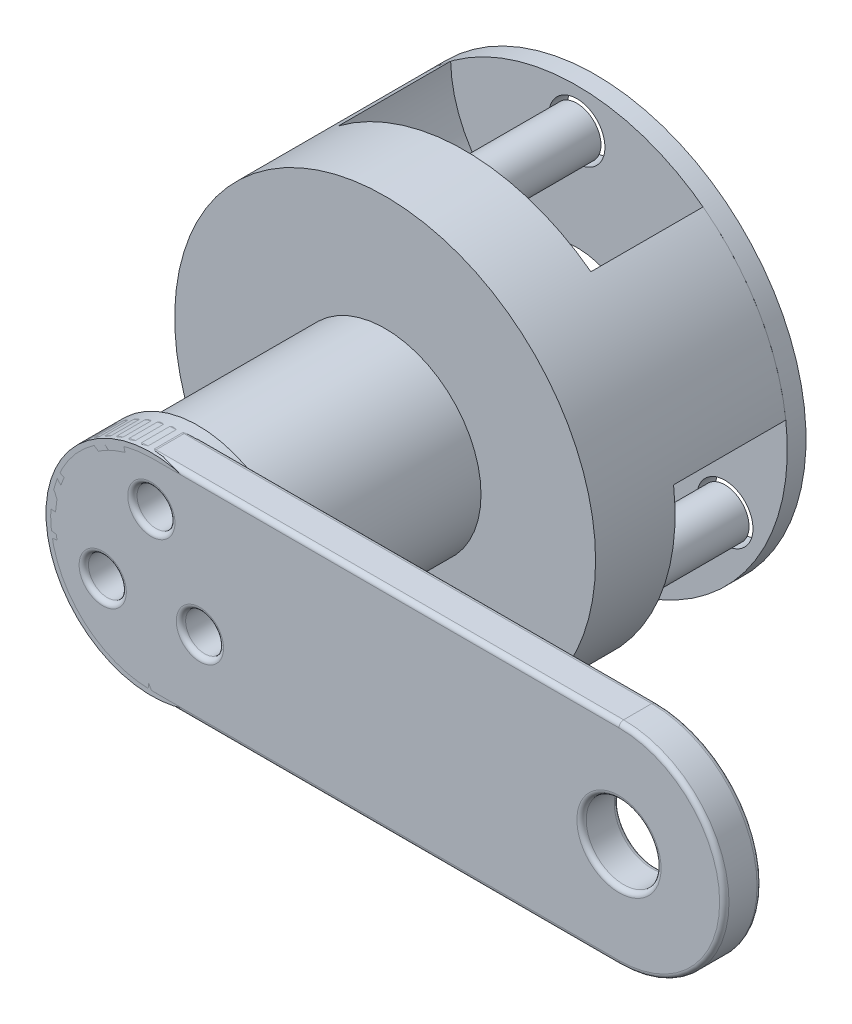
from build123d import *

# Parameters (mm, degrees)
BOSS_EXTRUDE1_DEPTH           = 2
BOSS_EXTRUDE1_DEPTH_BACK      = 17
SKETCH2_R                     = 22.5
CUT_EXTRUDE1_DEPTH            = 12
BOSS_EXTRUDE2_START           = -1.5
SKETCH4_R                     = 2.575
BOSS_EXTRUDE2_DEPTH           = 13.5
CIRPATTERN1_COUNT             = 3
SKETCH5_R                     = 11.15
BEARINGHOLE_DEPTH             = 7
BEARINGHOLE_DIRECTION_2_REACH = 36.007
SKETCH8_R                     = 22.5
BOSS_EXTRUDE4_DEPTH           = 1.5
SKETCH6_R                     = 10.25
BOSS_EXTRUDE3_DEPTH           = 20
FILLET1_R                     = 0.5
CIRPATTERN2_COUNT             = 3
SKETCH9_R                     = 22.5
SKETCH9_R_2                   = 7.5
SKETCH9_R_3                   = 3
SKETCH9_R_4                   = 2.25
BOSS_EXTRUDE5_DEPTH           = 2
SKETCH13_R                    = 11.265
SKETCH13_R_2                  = 10.265
BOSS_EXTRUDE6_DEPTH           = 5
SKETCH14_R                    = 2.025
SKETCH14_R_2                  = 4
BOSS_EXTRUDE7_DEPTH           = 4
FILLET2_R                     = 0.5


with BuildPart() as part:
    # Sketch2 → Boss-Extrude1 (new, two sides: drawn at the far end of the back side and taken through both)
    with BuildSketch(Plane.XY.offset(-BOSS_EXTRUDE1_DEPTH_BACK)):
        Circle(SKETCH2_R)
    extrude(amount=BOSS_EXTRUDE1_DEPTH + BOSS_EXTRUDE1_DEPTH_BACK)

    # Sketch3 → Cut-Extrude1 (cut)
    with BuildSketch(Plane(origin=(0, 0, -17), x_dir=(-1, 0, 0), z_dir=(0, 0, -1))):
        with BuildLine():
            ThreePointArc((5.14266063, 5.797891138), (0, 31.78), (-5.14266063, 5.797891138))
            ThreePointArc((-5.14266063, 5.797891138), (-6.711696879, 3.875), (-7.592451329, 1.55472918))
            ThreePointArc((-7.592451329, 1.55472918), (-27.522287332, -15.89), (-2.449790699, -7.352620317))
            ThreePointArc((-2.449790699, -7.352620317), (0, -7.75), (2.449790699, -7.352620317))
            ThreePointArc((2.449790699, -7.352620317), (27.522287332, -15.89), (7.592451329, 1.55472918))
            ThreePointArc((7.592451329, 1.55472918), (6.711696879, 3.875), (5.14266063, 5.797891138))
        make_face()
    extrude(amount=-CUT_EXTRUDE1_DEPTH, mode=Mode.SUBTRACT)

    # Sketch4 → Boss-Extrude2 (add)
    with BuildSketch(Plane(origin=(0, 0, -5), x_dir=(-1, 0, 0), z_dir=(0, 0, -1)).offset(BOSS_EXTRUDE2_START)):
        with Locations((0, 18.28)):
            Circle(SKETCH4_R)
    boss_extrude2 = extrude(amount=BOSS_EXTRUDE2_DEPTH)

    # CirPattern1: Boss-Extrude2 ×3 about axis
    cirpattern1_axis = Axis((0, 0, 0), (0, 0, 1))
    for i in range(1, CIRPATTERN1_COUNT):
        add(boss_extrude2.rotate(cirpattern1_axis, i * 360 / CIRPATTERN1_COUNT))

    # Sketch5 → bearingHole (cut)
    with BuildSketch(Plane(origin=(0, 0, -5), x_dir=(-1, 0, 0), z_dir=(0, 0, -1))):
        with Locations(Location((0, 0, 0), (0, 0, 162.658546609))):
            Circle(SKETCH5_R)
    extrude(amount=-BEARINGHOLE_DEPTH, mode=Mode.SUBTRACT)

    # bearingHole direction 2: up to this face of the body (flat: up to its plane)
    bearinghole_direction_2_end = Plane(part.part.faces().sort_by_distance((0, -16.708840738, -17))[0])
    # Sketch5 → bearingHole direction 2 (cut, up to the picked face)
    with BuildSketch(Plane(origin=(0, 0, -5), x_dir=(-1, 0, 0), z_dir=(0, 0, -1)), mode=Mode.PRIVATE) as bearinghole_direction_2_sk1:
        with Locations(Location((0, 0, 0), (0, 0, 162.658546609))):
            Circle(SKETCH5_R)
    bearinghole_direction_2_tool1 = split(extrude(bearinghole_direction_2_sk1.sketch, amount=BEARINGHOLE_DIRECTION_2_REACH, mode=Mode.PRIVATE), bisect_by=bearinghole_direction_2_end, keep=Keep.BOTH, mode=Mode.PRIVATE)
    add(bearinghole_direction_2_tool1.solids().sort_by(Axis((0, 0, -5), (0, 0, -1)))[0], mode=Mode.SUBTRACT)

    # Sketch8 → Boss-Extrude4 (add)
    with BuildSketch(Plane.XY.offset(2)):
        with Locations(Location((0, 0, 0), (0, 0, 173.13920452))):
            Circle(SKETCH8_R)
    extrude(amount=BOSS_EXTRUDE4_DEPTH)

    # Sketch6 → Boss-Extrude3 (add)
    with BuildSketch(Plane.XY.offset(3.5)):
        Circle(SKETCH6_R)
    extrude(amount=BOSS_EXTRUDE3_DEPTH)

    # Fillet1
    fillet1_edges = [part.edges().sort_by_distance(p)[0] for p in [
        (-10.643181204, -3.323431037, 2),
    ]]
    fillet(fillet1_edges, radius=FILLET1_R)

    # Sketch11 → Ø4.0mm Dowel Hole1 (revolve, cut)
    with BuildSketch(Plane(origin=(0, 6, 23.5), x_dir=(0, -1, 0), z_dir=(1, 0, 0))):
        Polygon((0, 0), (0, 5), (2, 3.798278762), (2, 0.025), (2.025, 0), align=None)
    f_4_0mm_dowel_hole1 = revolve(axis=Axis((0, 6, 29.85), (0, 0, -1)), mode=Mode.SUBTRACT)

    # CirPattern2: Ø4.0mm Dowel Hole1 ×3 about axis
    cirpattern2_axis = Axis((0, 0, 0), (0, 0, 1))
    for i in range(1, CIRPATTERN2_COUNT):
        add(f_4_0mm_dowel_hole1.rotate(cirpattern2_axis, i * 360 / CIRPATTERN2_COUNT), mode=Mode.SUBTRACT)


with BuildPart() as body_2:
    # Sketch9 → Boss-Extrude5 (new body)
    with BuildSketch(Plane(origin=(0, 0, -17), x_dir=(-1, 0, 0), z_dir=(0, 0, -1))):
        Circle(SKETCH9_R)
        Circle(SKETCH9_R_2, mode=Mode.SUBTRACT)
        with Locations((0, 18.28)):
            Circle(SKETCH9_R_3, mode=Mode.SUBTRACT)
        with Locations((15.830944381, -9.14)):
            Circle(SKETCH9_R_3, mode=Mode.SUBTRACT)
        with Locations((-15.830944381, -9.14)):
            Circle(SKETCH9_R_3, mode=Mode.SUBTRACT)
        with Locations((15.207753976, 8.780200852)):
            Circle(SKETCH9_R_4, mode=Mode.SUBTRACT)
        with Locations((0, -17.560401703)):
            Circle(SKETCH9_R_4, mode=Mode.SUBTRACT)
        with Locations((-15.207753976, 8.780200852)):
            Circle(SKETCH9_R_4, mode=Mode.SUBTRACT)
    extrude(amount=BOSS_EXTRUDE5_DEPTH)


with BuildPart() as body_3:
    # Sketch13 → Boss-Extrude6 (new body)
    with BuildSketch(Plane.XY.offset(23.5)):
        Circle(SKETCH13_R)
        Circle(SKETCH13_R_2, mode=Mode.SUBTRACT)
    extrude(amount=BOSS_EXTRUDE6_DEPTH)


with BuildPart() as body_4:
    # Sketch14 → Boss-Extrude7 (new body)
    with BuildSketch(Plane.XY.offset(28.5)):
        with BuildLine():
            Line((0, 11.265), (50, 11.265))
            ThreePointArc((50, 11.265), (61.265, 0), (50, -11.265))
            Line((50, -11.265), (0, -11.265))
            ThreePointArc((0, -11.265), (-11.265, 0), (0, 11.265))
        make_face()
        with Locations((0, 6)):
            Circle(SKETCH14_R, mode=Mode.SUBTRACT)
        with Locations((5.196152423, -3)):
            Circle(SKETCH14_R, mode=Mode.SUBTRACT)
        with Locations((-5.196152423, -3)):
            Circle(SKETCH14_R, mode=Mode.SUBTRACT)
        with Locations((50, 0)):
            Circle(SKETCH14_R_2, mode=Mode.SUBTRACT)
    extrude(amount=-BOSS_EXTRUDE7_DEPTH)

    # Fillet2
    fillet2_edges = [body_4.edges().sort_by_distance(p)[0] for p in [
        (-2.025, 6, 24.5),
        (-2.025, 6, 28.5),
        (61.265, 0, 24.5),
        (46, 0, 24.5),
        (46, 0, 28.5),
        (25, 11.265, 24.5),
        (3.171152423, -3, 24.5),
        (3.171152423, -3, 28.5),
        (-7.221152423, -3, 24.5),
        (-7.221152423, -3, 28.5),
        (-11.265, 0, 24.5),
        (25, 11.265, 28.5),
        (61.265, 0, 28.5),
        (25, -11.265, 28.5),
        (-11.265, 0, 28.5),
        (25, -11.265, 24.5),
    ]]
    fillet(fillet2_edges, radius=FILLET2_R)


solid = Compound([part.part, body_2.part, body_3.part, body_4.part])
